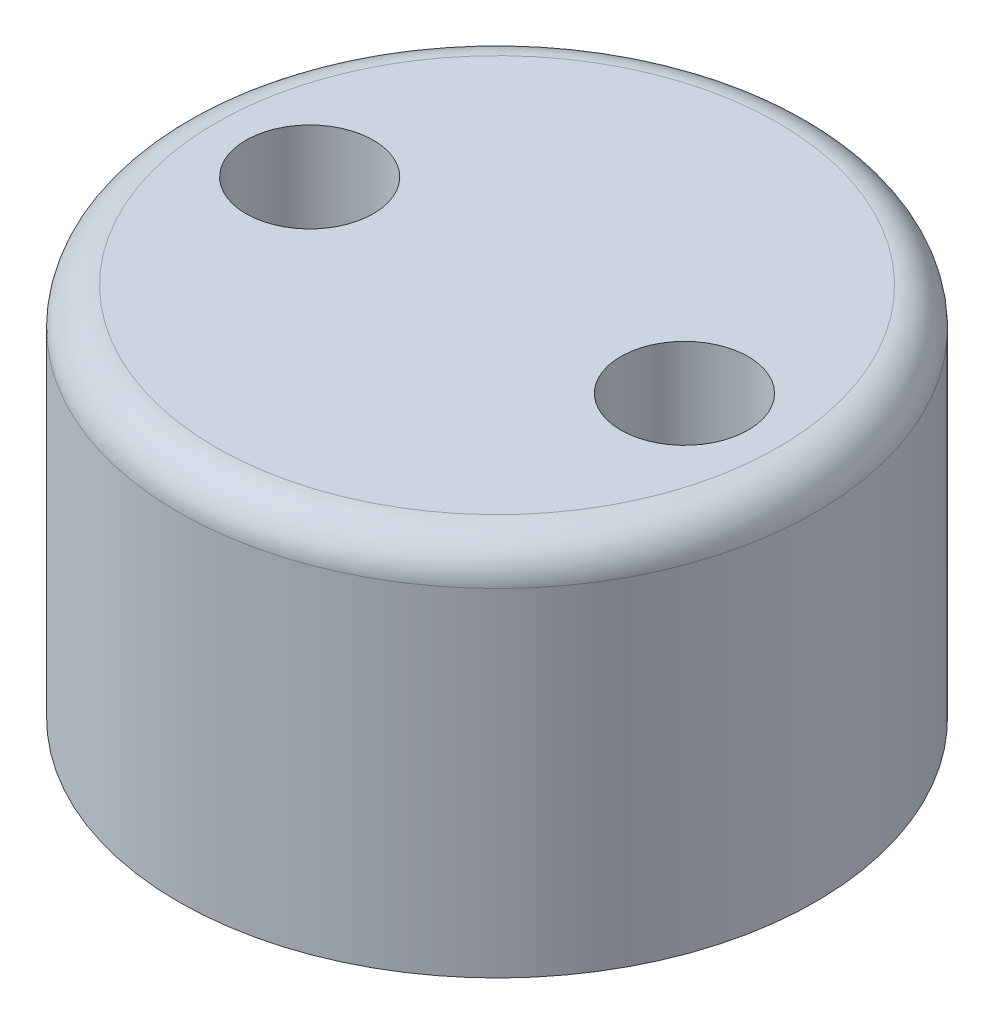
from build123d import *

# Parameters (mm, degrees)
SKETCH1_R            = 8.5
BOSS_EXTRUDE1_DEPTH  = 10
FILLET2_R            = 1
M3_CLEARANCE_HOLE1_D = 3.4


with BuildPart() as part:
    # Sketch1 → Boss-Extrude1 (new body)
    with BuildSketch(Plane(origin=(0, 0, 0), x_dir=(1, 0, 0), z_dir=(0, 1, 0))):
        with Locations(Location((0, 0, 0), (0, 0, 270))):
            Circle(SKETCH1_R)
    extrude(amount=BOSS_EXTRUDE1_DEPTH)

    # Fillet2
    fillet2_edges = [part.edges().sort_by_distance(p)[0] for p in [
        (0, 10, -8.5),
    ]]
    fillet(fillet2_edges, radius=FILLET2_R)

    # M3 Clearance Hole1 (through all)
    with Locations(Plane(origin=(0, 10, 0), x_dir=(1, 0, 0), z_dir=(0, 1, 0))):
        with Locations((-5, 0), (5, 0)):
            Hole(M3_CLEARANCE_HOLE1_D / 2)


solid = part.part
